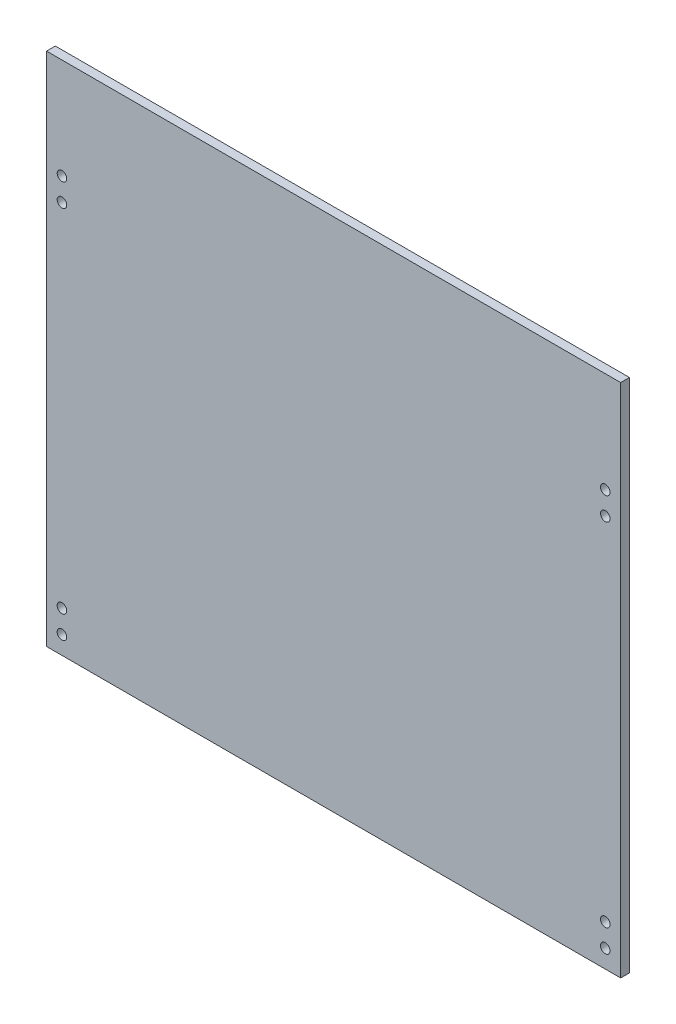
from build123d import *

# Parameters (mm, degrees)
SKETCH1_W           = 216
SKETCH1_H           = 194
SKETCH1_R           = 1.8
BOSS_EXTRUDE1_DEPTH = 3.302


with BuildPart() as part:
    # Sketch1 → Boss-Extrude1 (new body)
    with BuildSketch(Plane.XY):
        with Locations((34.846681922, -56.71624714)):
            Rectangle(SKETCH1_W, SKETCH1_H)
        with Locations(Location((-67.353318078, -146.91624714, 0), (0, 0, 180))):
            Circle(SKETCH1_R, mode=Mode.SUBTRACT)
        with Locations(Location((-67.353318078, -138.31624714, 0), (0, 0, 180))):
            Circle(SKETCH1_R, mode=Mode.SUBTRACT)
        with Locations(Location((-67.353318078, -6.11624714, 0), (0, 0, 180))):
            Circle(SKETCH1_R, mode=Mode.SUBTRACT)
        with Locations(Location((137.046681922, 2.48375286, 0), (0, 0, 180))):
            Circle(SKETCH1_R, mode=Mode.SUBTRACT)
        with Locations(Location((137.046681922, -146.91624714, 0), (0, 0, 180))):
            Circle(SKETCH1_R, mode=Mode.SUBTRACT)
        with Locations(Location((137.046681922, -138.31624714, 0), (0, 0, 180))):
            Circle(SKETCH1_R, mode=Mode.SUBTRACT)
        with Locations(Location((137.046681922, -6.11624714, 0), (0, 0, 180))):
            Circle(SKETCH1_R, mode=Mode.SUBTRACT)
        with Locations(Location((-67.353318078, 2.48375286, 0), (0, 0, 180))):
            Circle(SKETCH1_R, mode=Mode.SUBTRACT)
    extrude(amount=BOSS_EXTRUDE1_DEPTH)


solid = part.part
